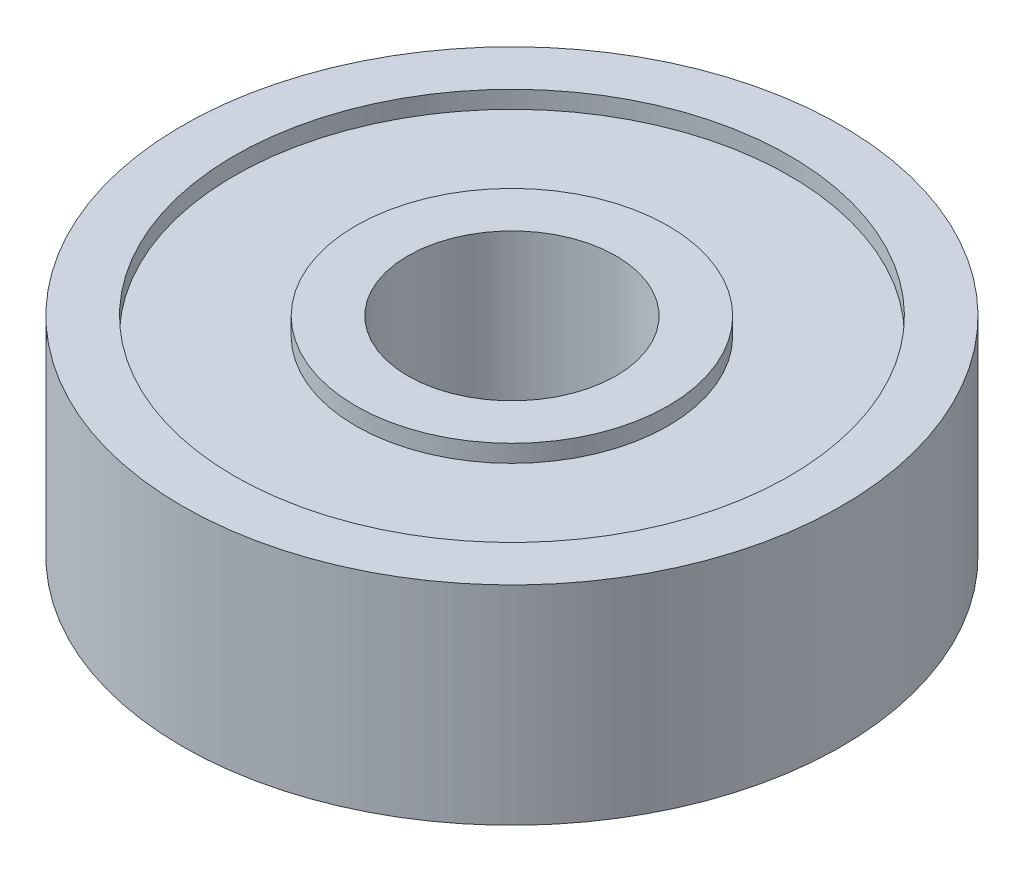
from build123d import *

# Parameters (mm, degrees)
ESBO_O1_W = 1.5
ESBO_O1_H = 6
ESBO_O2_W = 3.5
ESBO_O2_H = 5


with BuildPart() as part:
    # Esboço1 → Revolução1 (revolve)
    with BuildSketch(Plane.XY, mode=Mode.PRIVATE) as revolu_o1_sk:
        with Locations((3.75, 0)):
            Rectangle(ESBO_O1_W, ESBO_O1_H)
        with Locations((8.75, 0)):
            Rectangle(ESBO_O1_W, ESBO_O1_H)
    revolve(revolu_o1_sk.sketch.rotate(Axis((0, 13.877117288, 0), (0, -1, 0)), 90), axis=Axis((0, 13.877117288, 0), (0, -1, 0)))

    # Esboço2 → Revolução2 (revolve)
    with BuildSketch(Plane.XY, mode=Mode.PRIVATE) as revolu_o2_sk:
        with Locations((-6.25, 0)):
            Rectangle(ESBO_O2_W, ESBO_O2_H)
    revolve(revolu_o2_sk.sketch.rotate(Axis((0, 6.26823955, 0), (0, -1, 0)), 270), axis=Axis((0, 6.26823955, 0), (0, -1, 0)))


solid = part.part
